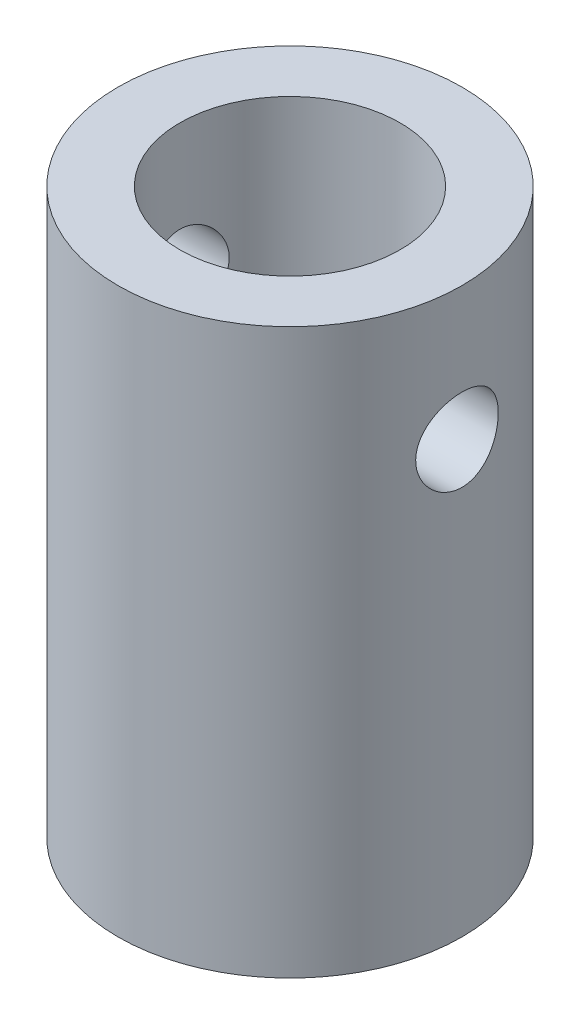
from build123d import *

# Parameters (mm, degrees)
SKETCH_1_R               = 12.5
EXTRUDE_1_DEPTH          = 41
SKETCH_2_R               = 8
CUT_EXTRUDE_1_DEPTH      = 19
CUT_EXTRUDE_2_DEPTH      = 45.648628254
CUT_EXTRUDE_2_DEPTH_BACK = 45.648628254
SKETCH_4_R               = 3


with BuildPart() as part:
    # 草图1 → 凸台-拉伸1 (new body)
    with BuildSketch(Plane(origin=(0, 0, 0), x_dir=(1, 0, 0), z_dir=(0, 1, 0))):
        with Locations(Location((0, 0, 0), (0, 0, 270))):
            Circle(SKETCH_1_R)
        with BuildLine():
            ThreePointArc((1.320081675, 7.281303755), (1.178664494, 7.305528729), (1.036804224, 7.32700737))
            add(Edge.make_bspline(
                [(1.036804224, 7.32700737), (0.981349652, 7.270157618), (0.925664276, 7.213171767), (0.822185543, 7.094937546), (0.774343887, 7.033715099), (0.635290922, 6.847559044), (0.548900943, 6.720025237), (0.477457546, 6.587144437)],
                knots=[0, 0, 0, 0, 0.25, 0.25, 0.5, 0.5, 1, 1, 1, 1], degree=3))
            add(Edge.make_bspline(
                [(0.477457546, 6.587144437), (0.465670482, 6.560002351), (0.446966495, 6.534634966), (0.392581447, 6.494187019), (0.354923032, 6.479375673), (0.274403838, 6.478342584), (0.234194601, 6.492926686), (0.177477992, 6.534562396), (0.158353178, 6.560913911), (0.146609234, 6.588640193)],
                knots=[0, 0, 0, 0, 0.25, 0.25, 0.5, 0.5, 0.75, 0.75, 1, 1, 1, 1], degree=3))
            add(Edge.make_bspline(
                [(0.146609234, 6.588640193), (0.087406412, 6.729534896), (0.022470706, 6.869008306), (-0.095794127, 7.071358543), (-0.138881021, 7.137641916), (-0.232486032, 7.266772188), (-0.282985734, 7.329709482), (-0.333258041, 7.392492075)],
                knots=[0, 0, 0, 0, 0.5, 0.5, 0.75, 0.75, 1, 1, 1, 1], degree=3))
            ThreePointArc((-0.333258041, 7.392492075), (-0.476520161, 7.384641395), (-0.619603145, 7.374014642))
            add(Edge.make_bspline(
                [(-0.619603145, 7.374014642), (-0.661016756, 7.306295373), (-0.702626315, 7.238396061), (-0.777131852, 7.100013493), (-0.810027468, 7.029653931), (-0.904545173, 6.817549796), (-0.961750638, 6.674495088), (-1.001808258, 6.529141787)],
                knots=[0, 0, 0, 0, 0.25, 0.25, 0.5, 0.5, 1, 1, 1, 1], degree=3))
            add(Edge.make_bspline(
                [(-1.001808258, 6.529141787), (-1.00726029, 6.500056407), (-1.019851275, 6.471161346), (-1.063877394, 6.419622783), (-1.097300474, 6.396802915), (-1.175575056, 6.377883569), (-1.218016449, 6.383157985), (-1.282568598, 6.411128867), (-1.307075952, 6.432562592), (-1.32469435, 6.456979365)],
                knots=[0, 0, 0, 0, 0.25, 0.25, 0.5, 0.5, 0.75, 0.75, 1, 1, 1, 1], degree=3))
            add(Edge.make_bspline(
                [(-1.32469435, 6.456979365), (-1.413614574, 6.580958145), (-1.50733275, 6.702515874), (-1.667328953, 6.873226276), (-1.724044413, 6.928139193), (-1.843879738, 7.033004611), (-1.907009881, 7.083047862), (-1.969886807, 7.132989973)],
                knots=[0, 0, 0, 0, 0.5, 0.5, 0.75, 0.75, 1, 1, 1, 1], degree=3))
            ThreePointArc((-1.969886807, 7.132989973), (-2.107810106, 7.093457306), (-2.244941026, 7.051258028))
            add(Edge.make_bspline(
                [(-2.244941026, 7.051258028), (-2.270240634, 6.976112089), (-2.295690848, 6.900747155), (-2.337400908, 6.749436272), (-2.353691732, 6.673613581), (-2.399065606, 6.44603228), (-2.424376538, 6.293898001), (-2.431078977, 6.143425776)],
                knots=[0, 0, 0, 0, 0.25, 0.25, 0.5, 0.5, 1, 1, 1, 1], degree=3))
            add(Edge.make_bspline(
                [(-2.431078977, 6.143425776), (-2.429922179, 6.113855693), (-2.435767989, 6.082881938), (-2.467225283, 6.0228357), (-2.494736026, 5.993149765), (-2.566842089, 5.957290187), (-2.609389832, 5.952991684), (-2.678542057, 5.965898104), (-2.707202858, 5.981340256), (-2.729811991, 6.001223702)],
                knots=[0, 0, 0, 0, 0.25, 0.25, 0.5, 0.5, 0.75, 0.75, 1, 1, 1, 1], degree=3))
            add(Edge.make_bspline(
                [(-2.729811991, 6.001223702), (-2.843877091, 6.102118361), (-2.961914777, 6.199724831), (-3.155568152, 6.330271891), (-3.222981858, 6.371086663), (-3.362905878, 6.446499746), (-3.43545494, 6.481176752), (-3.507737223, 6.51580997)],
                knots=[0, 0, 0, 0, 0.5, 0.5, 0.75, 0.75, 1, 1, 1, 1], degree=3))
            ThreePointArc((-3.507737223, 6.51580997), (-3.633405651, 6.446577647), (-3.75770819, 6.374921893))
            add(Edge.make_bspline(
                [(-3.75770819, 6.374921893), (-3.765661335, 6.296145746), (-3.773711673, 6.217123105), (-3.780628654, 6.060577536), (-3.779555086, 5.98316972), (-3.773567953, 5.751425564), (-3.765597829, 5.597330834), (-3.738685008, 5.449337815)],
                knots=[0, 0, 0, 0, 0.25, 0.25, 0.5, 0.5, 1, 1, 1, 1], degree=3))
            add(Edge.make_bspline(
                [(-3.738685008, 5.449337815), (-3.730977122, 5.420766048), (-3.729784017, 5.389267097), (-3.747092837, 5.323723878), (-3.767310281, 5.288659422), (-3.829632001, 5.237655307), (-3.870154862, 5.22399952), (-3.940441778, 5.221196026), (-3.971819073, 5.229873103), (-3.998285223, 5.244226695)],
                knots=[0, 0, 0, 0, 0.25, 0.25, 0.5, 0.5, 0.75, 0.75, 1, 1, 1, 1], degree=3))
            add(Edge.make_bspline(
                [(-3.998285223, 5.244226695), (-4.131679459, 5.317066828), (-4.268286416, 5.385729002), (-4.485811662, 5.469600321), (-4.560473939, 5.49433348), (-4.713371018, 5.53663568), (-4.791666925, 5.5542605), (-4.869695047, 5.571900047)],
                knots=[0, 0, 0, 0, 0.5, 0.5, 0.75, 0.75, 1, 1, 1, 1], degree=3))
            ThreePointArc((-4.869695047, 5.571900047), (-4.976807064, 5.476439667), (-5.082048173, 5.378920556))
            add(Edge.make_bspline(
                [(-5.082048173, 5.378920556), (-5.072307151, 5.300480381), (-5.062604806, 5.221779379), (-5.034518787, 5.06791266), (-5.016219273, 4.992847823), (-4.959223265, 4.768468173), (-4.918131697, 4.619753183), (-4.859057524, 4.481682373)],
                knots=[0, 0, 0, 0, 0.25, 0.25, 0.5, 0.5, 1, 1, 1, 1], degree=3))
            add(Edge.make_bspline(
                [(-4.859057524, 4.481682373), (-4.845184968, 4.455541927), (-4.837012483, 4.425097777), (-4.839303133, 4.357344949), (-4.851211988, 4.318660124), (-4.90062315, 4.255067306), (-4.93709085, 4.232738081), (-5.004990319, 4.214365565), (-5.037511239, 4.215842974), (-5.066507502, 4.223947335)],
                knots=[0, 0, 0, 0, 0.25, 0.25, 0.5, 0.5, 0.75, 0.75, 1, 1, 1, 1], degree=3))
            add(Edge.make_bspline(
                [(-5.066507502, 4.223947335), (-5.212479984, 4.265197318), (-5.360842679, 4.301259016), (-5.591236122, 4.334292186), (-5.669365776, 4.341792836), (-5.827522419, 4.349018186), (-5.907622429, 4.348769055), (-5.987466028, 4.348591789)],
                knots=[0, 0, 0, 0, 0.5, 0.5, 0.75, 0.75, 1, 1, 1, 1], degree=3))
            ThreePointArc((-5.987466028, 4.348591789), (-6.07065059, 4.231690135), (-6.151553041, 4.113197681))
            add(Edge.make_bspline(
                [(-6.151553041, 4.113197681), (-6.124665563, 4.039025234), (-6.097756481, 3.964591682), (-6.036232892, 3.821126102), (-6.001721665, 3.75217647), (-5.896624578, 3.54632475), (-5.824172679, 3.410224986), (-5.73601637, 3.288981735)],
                knots=[0, 0, 0, 0, 0.25, 0.25, 0.5, 0.5, 1, 1, 1, 1], degree=3))
            add(Edge.make_bspline(
                [(-5.73601637, 3.288981735), (-5.716674868, 3.26658366), (-5.70193286, 3.238721432), (-5.68908961, 3.172157886), (-5.692091566, 3.131793216), (-5.726112744, 3.058799878), (-5.756697382, 3.028915331), (-5.818806502, 2.995894044), (-5.850840963, 2.990097794), (-5.880913702, 2.99154669)],
                knots=[0, 0, 0, 0, 0.25, 0.25, 0.5, 0.5, 0.75, 0.75, 1, 1, 1, 1], degree=3))
            add(Edge.make_bspline(
                [(-5.880913702, 2.99154669), (-6.03212545, 2.999266228), (-6.184669855, 3.000659405), (-6.416269572, 2.981259188), (-6.493951948, 2.971250179), (-6.649452266, 2.943197824), (-6.727342999, 2.925149799), (-6.80500046, 2.907226981)],
                knots=[0, 0, 0, 0, 0.5, 0.5, 0.75, 0.75, 1, 1, 1, 1], degree=3))
            ThreePointArc((-6.80500046, 2.907226981), (-6.860086346, 2.774745989), (-6.912593353, 2.641221899))
            add(Edge.make_bspline(
                [(-6.912593353, 2.641221899), (-6.869966678, 2.575015519), (-6.82725982, 2.508561801), (-6.73553422, 2.382638228), (-6.686632649, 2.323229472), (-6.538755143, 2.146143868), (-6.438293852, 2.029438921), (-6.325587166, 1.931042891)],
                knots=[0, 0, 0, 0, 0.25, 0.25, 0.5, 0.5, 1, 1, 1, 1], degree=3))
            add(Edge.make_bspline(
                [(-6.325587166, 1.931042891), (-6.301746825, 1.91351047), (-6.281174899, 1.889627674), (-6.253842011, 1.827592924), (-6.247786065, 1.787573767), (-6.264709487, 1.708840723), (-6.287877013, 1.67289766), (-6.341082222, 1.626881406), (-6.371024466, 1.614101801), (-6.400666096, 1.608822473)],
                knots=[0, 0, 0, 0, 0.25, 0.25, 0.5, 0.5, 0.75, 0.75, 1, 1, 1, 1], degree=3))
            add(Edge.make_bspline(
                [(-6.400666096, 1.608822473), (-6.549559073, 1.582743795), (-6.698324927, 1.549172856), (-6.919406344, 1.478394292), (-6.992789955, 1.451467307), (-7.137909136, 1.389684274), (-7.209706127, 1.354796727), (-7.281303754, 1.320081673)],
                knots=[0, 0, 0, 0, 0.5, 0.5, 0.75, 0.75, 1, 1, 1, 1], degree=3))
            ThreePointArc((-7.281303754, 1.320081673), (-7.305528728, 1.178664492), (-7.327007369, 1.036804222))
            add(Edge.make_bspline(
                [(-7.327007369, 1.036804222), (-7.270829338, 0.981845361), (-7.214517578, 0.926666067), (-7.097308165, 0.824494804), (-7.03653664, 0.77754061), (-6.853346183, 0.638018121), (-6.729723914, 0.546669005), (-6.598206372, 0.475958565)],
                knots=[0, 0, 0, 0, 0.25, 0.25, 0.5, 0.5, 1, 1, 1, 1], degree=3))
            add(Edge.make_bspline(
                [(-6.598206372, 0.475958565), (-6.571624676, 0.463639432), (-6.546877047, 0.444637459), (-6.507538992, 0.390166285), (-6.493277365, 0.35281192), (-6.492280061, 0.273518396), (-6.506240232, 0.233785027), (-6.546781433, 0.176863082), (-6.572509336, 0.157415149), (-6.599702128, 0.145110252)],
                knots=[0, 0, 0, 0, 0.25, 0.25, 0.5, 0.5, 0.75, 0.75, 1, 1, 1, 1], degree=3))
            add(Edge.make_bspline(
                [(-6.599702128, 0.145110252), (-6.738870055, 0.086632861), (-6.875941631, 0.019665553), (-7.0753157, -0.09884181), (-7.140797266, -0.141273025), (-7.268373923, -0.233592416), (-7.330511035, -0.283531059), (-7.392492073, -0.333258043)],
                knots=[0, 0, 0, 0, 0.5, 0.5, 0.75, 0.75, 1, 1, 1, 1], degree=3))
            ThreePointArc((-7.392492073, -0.333258043), (-7.384641393, -0.476520163), (-7.37401464, -0.619603147))
            add(Edge.make_bspline(
                [(-7.37401464, -0.619603147), (-7.307137232, -0.660609027), (-7.240080525, -0.70179702), (-7.103332749, -0.775228732), (-7.033771874, -0.807459702), (-6.824506901, -0.902506121), (-6.683886012, -0.96371013), (-6.540203721, -1.00330724)],
                knots=[0, 0, 0, 0, 0.25, 0.25, 0.5, 0.5, 1, 1, 1, 1], degree=3))
            add(Edge.make_bspline(
                [(-6.540203721, -1.00330724), (-6.511347253, -1.00910232), (-6.48273997, -1.021921219), (-6.431772233, -1.066116529), (-6.409274205, -1.099443431), (-6.390513759, -1.177071883), (-6.395515724, -1.219205987), (-6.422889995, -1.283735746), (-6.44396635, -1.308345255), (-6.4680413, -1.326193332)],
                knots=[0, 0, 0, 0, 0.25, 0.25, 0.5, 0.5, 0.75, 0.75, 1, 1, 1, 1], degree=3))
            add(Edge.make_bspline(
                [(-6.4680413, -1.326193332), (-6.59058573, -1.414084809), (-6.708551771, -1.511042288), (-6.876132512, -1.671225086), (-6.930522798, -1.727007263), (-7.034294677, -1.845195621), (-7.0836949, -1.907661656), (-7.132989972, -1.969886809)],
                knots=[0, 0, 0, 0, 0.5, 0.5, 0.75, 0.75, 1, 1, 1, 1], degree=3))
            ThreePointArc((-7.132989972, -1.969886809), (-7.093457304, -2.107810108), (-7.051258027, -2.244941028))
            add(Edge.make_bspline(
                [(-7.051258027, -2.244941028), (-6.977050626, -2.269992264), (-6.902628683, -2.295178254), (-6.753208403, -2.336331226), (-6.678338982, -2.352311874), (-6.453543437, -2.398199602), (-6.303121796, -2.425957395), (-6.15448771, -2.432577959)],
                knots=[0, 0, 0, 0, 0.25, 0.25, 0.5, 0.5, 1, 1, 1, 1], degree=3))
            add(Edge.make_bspline(
                [(-6.15448771, -2.432577959), (-6.124965793, -2.431542676), (-6.094067851, -2.437477983), (-6.034193535, -2.469017996), (-6.004615509, -2.49651281), (-5.968842441, -2.568418581), (-5.964471905, -2.610863097), (-5.977193324, -2.679979868), (-5.99252125, -2.70865298), (-6.012285637, -2.731310973)],
                knots=[0, 0, 0, 0, 0.25, 0.25, 0.5, 0.5, 0.75, 0.75, 1, 1, 1, 1], degree=3))
            add(Edge.make_bspline(
                [(-6.012285637, -2.731310973), (-6.112142186, -2.844202249), (-6.204549345, -2.966054877), (-6.331861182, -3.159767754), (-6.372526394, -3.226120105), (-6.447417198, -3.364273667), (-6.481637938, -3.436134768), (-6.515809968, -3.507737225)],
                knots=[0, 0, 0, 0, 0.5, 0.5, 0.75, 0.75, 1, 1, 1, 1], degree=3))
            ThreePointArc((-6.515809968, -3.507737225), (-6.446577646, -3.633405653), (-6.374921892, -3.757708191))
            add(Edge.make_bspline(
                [(-6.374921892, -3.757708191), (-6.297102392, -3.765598577), (-6.219045058, -3.773570127), (-6.064397235, -3.7805044), (-5.987928244, -3.779507791), (-5.758921712, -3.774016922), (-5.606565561, -3.76676453), (-5.46039975, -3.740183989)],
                knots=[0, 0, 0, 0, 0.25, 0.25, 0.5, 0.5, 1, 1, 1, 1], degree=3))
            add(Edge.make_bspline(
                [(-5.46039975, -3.740183989), (-5.431823438, -3.732418074), (-5.400308518, -3.731177546), (-5.33472048, -3.748415503), (-5.299616829, -3.768608497), (-5.248540204, -3.830981636), (-5.234880469, -3.871572018), (-5.232141537, -3.941927929), (-5.240873658, -3.973321938), (-5.25528863, -3.999784205)],
                knots=[0, 0, 0, 0, 0.25, 0.25, 0.5, 0.5, 0.75, 0.75, 1, 1, 1, 1], degree=3))
            add(Edge.make_bspline(
                [(-5.25528863, -3.999784205), (-5.327511436, -4.132047912), (-5.389270513, -4.272286498), (-5.469870447, -4.489707851), (-5.494845984, -4.563356811), (-5.537194429, -4.714621993), (-5.55454184, -4.792290433), (-5.571900045, -4.869695049)],
                knots=[0, 0, 0, 0, 0.5, 0.5, 0.75, 0.75, 1, 1, 1, 1], degree=3))
            ThreePointArc((-5.571900045, -4.869695049), (-5.476439666, -4.976807066), (-5.378920554, -5.082048175))
            add(Edge.make_bspline(
                [(-5.378920554, -5.082048175), (-5.301372784, -5.072419594), (-5.223576683, -5.062815368), (-5.071366045, -5.03526514), (-4.997058758, -5.017385835), (-4.77537013, -4.96086732), (-4.629176423, -4.918929556), (-4.492744308, -4.860556506)],
                knots=[0, 0, 0, 0, 0.25, 0.25, 0.5, 0.5, 1, 1, 1, 1], degree=3))
            add(Edge.make_bspline(
                [(-4.492744308, -4.860556506), (-4.466621178, -4.846540536), (-4.436157615, -4.838243813), (-4.368313367, -4.840349291), (-4.329535438, -4.852192893), (-4.265745409, -4.901715291), (-4.243394364, -4.938335211), (-4.225157197, -5.006410791), (-4.226757263, -5.038991519), (-4.23500927, -5.068006484)],
                knots=[0, 0, 0, 0, 0.25, 0.25, 0.5, 0.5, 0.75, 0.75, 1, 1, 1, 1], degree=3))
            add(Edge.make_bspline(
                [(-4.23500927, -5.068006484), (-4.276003086, -5.213071968), (-4.303709719, -5.364153749), (-4.33350538, -5.594282073), (-4.341580001, -5.671613239), (-4.349304528, -5.82851082), (-4.348912849, -5.908116317), (-4.348591788, -5.987466029)],
                knots=[0, 0, 0, 0, 0.5, 0.5, 0.75, 0.75, 1, 1, 1, 1], degree=3))
            ThreePointArc((-4.348591788, -5.987466029), (-4.231690133, -6.070650592), (-4.113197679, -6.151553043))
            add(Edge.make_bspline(
                [(-4.113197679, -6.151553043), (-4.039783557, -6.124908026), (-3.966123502, -6.098230328), (-3.823872386, -6.037603172), (-3.755367485, -6.003743255), (-3.552160678, -5.899099439), (-3.419978777, -5.824720506), (-3.30004367, -5.737515351)],
                knots=[0, 0, 0, 0, 0.25, 0.25, 0.5, 0.5, 1, 1, 1, 1], degree=3))
            add(Edge.make_bspline(
                [(-3.30004367, -5.737515351), (-3.277689092, -5.71805789), (-3.24983757, -5.703209451), (-3.183244495, -5.690191206), (-3.142821582, -5.69311477), (-3.069641505, -5.727178305), (-3.039697099, -5.757887731), (-3.006744701, -5.820180346), (-3.001039092, -5.852293203), (-3.002608625, -5.882412684)],
                knots=[0, 0, 0, 0, 0.25, 0.25, 0.5, 0.5, 0.75, 0.75, 1, 1, 1, 1], degree=3))
            add(Edge.make_bspline(
                [(-3.002608625, -5.882412684), (-3.010300364, -6.033077262), (-3.002439503, -6.186882044), (-2.979889361, -6.418088259), (-2.970658463, -6.495310424), (-2.943353056, -6.650084899), (-2.925226109, -6.727659925), (-2.90722698, -6.805000462)],
                knots=[0, 0, 0, 0, 0.5, 0.5, 0.75, 0.75, 1, 1, 1, 1], degree=3))
            ThreePointArc((-2.90722698, -6.805000462), (-2.774745987, -6.860086348), (-2.641221897, -6.912593354))
            add(Edge.make_bspline(
                [(-2.641221897, -6.912593354), (-2.575596367, -6.870268028), (-2.509739633, -6.827855557), (-2.384476825, -6.737158649), (-2.325130049, -6.688981029), (-2.150649191, -6.541521223), (-2.039600759, -6.438761828), (-1.942104826, -6.327086148)],
                knots=[0, 0, 0, 0, 0.25, 0.25, 0.5, 0.5, 1, 1, 1, 1], degree=3))
            add(Edge.make_bspline(
                [(-1.942104826, -6.327086148), (-1.924576726, -6.303251682), (-1.900704328, -6.282688722), (-1.838714468, -6.25535891), (-1.798727922, -6.249288233), (-1.720006886, -6.266163114), (-1.684018356, -6.289323559), (-1.637952406, -6.342555239), (-1.62516554, -6.37251332), (-1.619884408, -6.402165078)],
                knots=[0, 0, 0, 0, 0.25, 0.25, 0.5, 0.5, 0.75, 0.75, 1, 1, 1, 1], degree=3))
            add(Edge.make_bspline(
                [(-1.619884408, -6.402165078), (-1.593827275, -6.550935046), (-1.550844135, -6.699256637), (-1.477031364, -6.919865933), (-1.450918129, -6.993182563), (-1.389876037, -7.138164228), (-1.354889163, -7.209834281), (-1.320081671, -7.281303756)],
                knots=[0, 0, 0, 0, 0.5, 0.5, 0.75, 0.75, 1, 1, 1, 1], degree=3))
            ThreePointArc((-1.320081671, -7.281303756), (-1.178664491, -7.30552873), (-1.036804221, -7.327007371))
            add(Edge.make_bspline(
                [(-1.036804221, -7.327007371), (-0.982256493, -7.271122895), (-0.927503812, -7.21509805), (-0.825564243, -7.098956368), (-0.778328661, -7.038868824), (-0.641325167, -6.855985119), (-0.557241731, -6.730312994), (-0.487020499, -6.599705353)],
                knots=[0, 0, 0, 0, 0.25, 0.25, 0.5, 0.5, 1, 1, 1, 1], degree=3))
            add(Edge.make_bspline(
                [(-0.487020499, -6.599705353), (-0.47508062, -6.572732966), (-0.456296871, -6.547556103), (-0.401927858, -6.507444512), (-0.364389197, -6.492787345), (-0.284254989, -6.491722616), (-0.244139503, -6.506109386), (-0.187317372, -6.547434913), (-0.16808403, -6.573620987), (-0.156172187, -6.601201109)],
                knots=[0, 0, 0, 0, 0.25, 0.25, 0.5, 0.5, 0.75, 0.75, 1, 1, 1, 1], degree=3))
            add(Edge.make_bspline(
                [(-0.156172187, -6.601201109), (-0.09757707, -6.740649557), (-0.021812833, -6.875679489), (0.09961068, -7.074555161), (0.141367623, -7.140338524), (0.233204147, -7.268305365), (0.283342297, -7.330476435), (0.333258045, -7.392492075)],
                knots=[0, 0, 0, 0, 0.5, 0.5, 0.75, 0.75, 1, 1, 1, 1], degree=3))
            ThreePointArc((0.333258045, -7.392492075), (0.476520165, -7.384641395), (0.619603149, -7.374014642))
            add(Edge.make_bspline(
                [(0.619603149, -7.374014642), (0.660370817, -7.307311833), (0.701308061, -7.240430228), (0.775084868, -7.104238162), (0.80792671, -7.035045769), (0.900383072, -6.826095977), (0.952825915, -6.684740119), (0.992245305, -6.541702703)],
                knots=[0, 0, 0, 0, 0.25, 0.25, 0.5, 0.5, 1, 1, 1, 1], degree=3))
            add(Edge.make_bspline(
                [(0.992245305, -6.541702703), (0.997695814, -6.512625446), (1.010280616, -6.483744594), (1.05426251, -6.4322312), (1.087645053, -6.409412425), (1.165883135, -6.390449487), (1.208367328, -6.395694154), (1.272983503, -6.42366762), (1.29750615, -6.445114017), (1.315131397, -6.469540282)],
                knots=[0, 0, 0, 0, 0.25, 0.25, 0.5, 0.5, 0.75, 0.75, 1, 1, 1, 1], degree=3))
            add(Edge.make_bspline(
                [(1.315131397, -6.469540282), (1.403440777, -6.592667381), (1.507935267, -6.70743162), (1.670932878, -6.874532703), (1.726326575, -6.929495134), (1.84449087, -7.034020792), (1.90731599, -7.083555964), (1.96988681, -7.132989974)],
                knots=[0, 0, 0, 0, 0.5, 0.5, 0.75, 0.75, 1, 1, 1, 1], degree=3))
            ThreePointArc((1.96988681, -7.132989974), (2.10781011, -7.093457306), (2.244941029, -7.051258029))
            add(Edge.make_bspline(
                [(2.244941029, -7.051258029), (2.269850955, -6.97706445), (2.294886901, -6.902658683), (2.336639302, -6.753282033), (2.353386828, -6.678422881), (2.396638686, -6.453899016), (2.414906715, -6.304368104), (2.421516024, -6.155986692)],
                knots=[0, 0, 0, 0, 0.25, 0.25, 0.5, 0.5, 1, 1, 1, 1], degree=3))
            add(Edge.make_bspline(
                [(2.421516024, -6.155986692), (2.420359756, -6.126430154), (2.426069122, -6.095760585), (2.457666065, -6.035331432), (2.485143193, -6.005707167), (2.557440536, -5.969789245), (2.599530869, -5.965522609), (2.669026951, -5.978442785), (2.697639292, -5.993900633), (2.720249038, -6.013784619)],
                knots=[0, 0, 0, 0, 0.25, 0.25, 0.5, 0.5, 0.75, 0.75, 1, 1, 1, 1], degree=3))
            add(Edge.make_bspline(
                [(2.720249038, -6.013784619), (2.833958278, -6.114364687), (2.96170608, -6.203082965), (3.158160332, -6.32996766), (3.224498157, -6.371323427), (3.363196324, -6.447096548), (3.435603286, -6.481473533), (3.507737226, -6.51580997)],
                knots=[0, 0, 0, 0, 0.5, 0.5, 0.75, 0.75, 1, 1, 1, 1], degree=3))
            ThreePointArc((3.507737226, -6.51580997), (3.633405654, -6.446577648), (3.757708193, -6.374921894))
            add(Edge.make_bspline(
                [(3.757708193, -6.374921894), (3.765474725, -6.296929183), (3.773317868, -6.218701023), (3.780860724, -6.06352427), (3.780615647, -5.986675003), (3.772409597, -5.757927451), (3.755734547, -5.608240252), (3.729122055, -5.461898731)],
                knots=[0, 0, 0, 0, 0.25, 0.25, 0.5, 0.5, 1, 1, 1, 1], degree=3))
            add(Edge.make_bspline(
                [(3.729122055, -5.461898731), (3.721416488, -5.433335564), (3.720234331, -5.401798135), (3.737502505, -5.336368127), (3.75765594, -5.301330536), (3.81997129, -5.25026093), (3.860512936, -5.236574857), (3.930842794, -5.233747128), (3.962245648, -5.242428341), (3.98872227, -5.256787612)],
                knots=[0, 0, 0, 0, 0.25, 0.25, 0.5, 0.5, 0.75, 0.75, 1, 1, 1, 1], degree=3))
            add(Edge.make_bspline(
                [(3.98872227, -5.256787612), (4.122223545, -5.329686194), (4.266671227, -5.388035486), (4.48679327, -5.46828415), (4.560814601, -5.493894216), (4.713190585, -5.536993747), (4.791581443, -5.55443533), (4.86969505, -5.571900047)],
                knots=[0, 0, 0, 0, 0.5, 0.5, 0.75, 0.75, 1, 1, 1, 1], degree=3))
            ThreePointArc((4.86969505, -5.571900047), (4.976807067, -5.476439668), (5.082048177, -5.378920556))
            add(Edge.make_bspline(
                [(5.082048177, -5.378920556), (5.072230204, -5.301023499), (5.062435763, -5.222878746), (5.035256042, -5.069618206), (5.017944368, -4.994585651), (4.958615658, -4.773190078), (4.908104484, -4.631229012), (4.849494571, -4.49424329)],
                knots=[0, 0, 0, 0, 0.25, 0.25, 0.5, 0.5, 1, 1, 1, 1], degree=3))
            add(Edge.make_bspline(
                [(4.849494571, -4.49424329), (4.835616181, -4.468091849), (4.82742791, -4.437775543), (4.829768155, -4.369602472), (4.841358939, -4.331530264), (4.891563585, -4.267044762), (4.927578901, -4.245279052), (4.995435031, -4.226930557), (5.027959785, -4.228407105), (5.056944549, -4.236508252)],
                knots=[0, 0, 0, 0, 0.25, 0.25, 0.5, 0.5, 0.75, 0.75, 1, 1, 1, 1], degree=3))
            add(Edge.make_bspline(
                [(5.056944549, -4.236508252), (5.203602865, -4.277952184), (5.357503846, -4.303228143), (5.590327448, -4.332763287), (5.668353867, -4.341254566), (5.826814134, -4.34936546), (5.907273351, -4.34893547), (5.987466031, -4.34859179)],
                knots=[0, 0, 0, 0, 0.5, 0.5, 0.75, 0.75, 1, 1, 1, 1], degree=3))
            ThreePointArc((5.987466031, -4.34859179), (6.070650593, -4.231690135), (6.151553044, -4.113197681))
            add(Edge.make_bspline(
                [(6.151553044, -4.113197681), (6.124583135, -4.039304217), (6.097582281, -3.965162295), (6.036886714, -3.821494048), (6.003278495, -3.752033399), (5.895740816, -3.549204005), (5.8142434, -3.422282087), (5.726453416, -3.301542652)],
                knots=[0, 0, 0, 0, 0.25, 0.25, 0.5, 0.5, 1, 1, 1, 1], degree=3))
            add(Edge.make_bspline(
                [(5.726453416, -3.301542652), (5.707115492, -3.279148719), (5.692380097, -3.251285782), (5.679535315, -3.184812979), (5.682557949, -3.144179133), (5.716699766, -3.071151665), (5.746867427, -3.041630157), (5.809415926, -3.008351378), (5.841300645, -3.002659801), (5.871350749, -3.004107606)],
                knots=[0, 0, 0, 0, 0.25, 0.25, 0.5, 0.5, 0.75, 0.75, 1, 1, 1, 1], degree=3))
            add(Edge.make_bspline(
                [(5.871350749, -3.004107606), (6.023828682, -3.011891921), (6.179631424, -3.003072451), (6.413565409, -2.980358974), (6.491678395, -2.971209579), (6.648263694, -2.94376439), (6.726752763, -2.925423003), (6.805000463, -2.907226982)],
                knots=[0, 0, 0, 0, 0.5, 0.5, 0.75, 0.75, 1, 1, 1, 1], degree=3))
            ThreePointArc((6.805000463, -2.907226982), (6.860086349, -2.774745989), (6.912593356, -2.641221899))
            add(Edge.make_bspline(
                [(6.912593356, -2.641221899), (6.869764682, -2.575058863), (6.826851516, -2.508658174), (6.735532409, -2.381837093), (6.687221535, -2.321464742), (6.536822947, -2.147482722), (6.428704851, -2.041977097), (6.316024213, -1.943603808)],
                knots=[0, 0, 0, 0, 0.25, 0.25, 0.5, 0.5, 1, 1, 1, 1], degree=3))
            add(Edge.make_bspline(
                [(6.316024213, -1.943603808), (6.2922028, -1.926085306), (6.271651917, -1.902231085), (6.244322403, -1.840300295), (6.238219619, -1.80007818), (6.255178792, -1.721324441), (6.278134548, -1.685622461), (6.331648587, -1.639321858), (6.361473632, -1.626660559), (6.391103143, -1.62138339)],
                knots=[0, 0, 0, 0, 0.25, 0.25, 0.5, 0.5, 0.75, 0.75, 1, 1, 1, 1], degree=3))
            add(Edge.make_bspline(
                [(6.391103143, -1.62138339), (6.541729216, -1.595001159), (6.691947572, -1.552723515), (6.91535722, -1.478839564), (6.989595585, -1.452422514), (7.136382964, -1.390656815), (7.208944939, -1.355270783), (7.281303757, -1.320081673)],
                knots=[0, 0, 0, 0, 0.5, 0.5, 0.75, 0.75, 1, 1, 1, 1], degree=3))
            ThreePointArc((7.281303757, -1.320081673), (7.305528731, -1.178664493), (7.327007372, -1.036804223))
            add(Edge.make_bspline(
                [(7.327007372, -1.036804223), (7.270516284, -0.981524202), (7.213846991, -0.926100449), (7.096137233, -0.823440055), (7.035290399, -0.775846781), (6.912053504, -0.683229244), (6.849785585, -0.638082087), (6.721178436, -0.557651365), (6.655248606, -0.52212664), (6.588643419, -0.488519481)],
                knots=[0, 0, 0, 0, 0.25, 0.25, 0.5, 0.5, 0.75, 0.75, 1, 1, 1, 1], degree=3))
            add(Edge.make_bspline(
                [(6.588643419, -0.488519481), (6.561514448, -0.476738112), (6.536164366, -0.45804855), (6.495734212, -0.403728945), (6.480880632, -0.36632396), (6.479835774, -0.285141211), (6.494187286, -0.245600896), (6.536230185, -0.188290374), (6.562423342, -0.169410687), (6.590139175, -0.157671168)],
                knots=[0, 0, 0, 0, 0.25, 0.25, 0.5, 0.5, 0.75, 0.75, 1, 1, 1, 1], degree=3))
            add(Edge.make_bspline(
                [(6.590139175, -0.157671168), (6.731618186, -0.099892576), (6.869008549, -0.025561734), (7.070502773, 0.096970962), (7.137119202, 0.13919962), (7.266757099, 0.231958075), (7.329709779, 0.282708601), (7.392492077, 0.333258043)],
                knots=[0, 0, 0, 0, 0.5, 0.5, 0.75, 0.75, 1, 1, 1, 1], degree=3))
            ThreePointArc((7.392492077, 0.333258043), (7.384641397, 0.476520163), (7.374014644, 0.619603147))
            add(Edge.make_bspline(
                [(7.374014644, 0.619603147), (7.306468659, 0.660973002), (7.238741538, 0.702534707), (7.100647141, 0.776668242), (7.030396295, 0.809267586), (6.81893941, 0.904598163), (6.676384082, 0.963426857), (6.530640768, 0.990746324)],
                knots=[0, 0, 0, 0, 0.25, 0.25, 0.5, 0.5, 1, 1, 1, 1], degree=3))
            add(Edge.make_bspline(
                [(6.530640768, 0.990746324), (6.501535922, 0.996202004), (6.472626588, 1.00880555), (6.421078038, 1.052865443), (6.398257212, 1.086312078), (6.379372333, 1.164667049), (6.384468218, 1.20646111), (6.412724381, 1.27178706), (6.434058856, 1.296012056), (6.458478347, 1.313632416)],
                knots=[0, 0, 0, 0, 0.25, 0.25, 0.5, 0.5, 0.75, 0.75, 1, 1, 1, 1], degree=3))
            add(Edge.make_bspline(
                [(6.458478347, 1.313632416), (6.583020119, 1.402956429), (6.701516533, 1.504128764), (6.871668459, 1.667094161), (6.927135265, 1.723414572), (7.032747432, 1.843193705), (7.082917285, 1.906673569), (7.132989975, 1.969886808)],
                knots=[0, 0, 0, 0, 0.5, 0.5, 0.75, 0.75, 1, 1, 1, 1], degree=3))
            ThreePointArc((7.132989975, 1.969886808), (7.093457308, 2.107810107), (7.05125803, 2.244941027))
            add(Edge.make_bspline(
                [(7.05125803, 2.244941027), (6.976123482, 2.270098672), (6.90077238, 2.295397669), (6.749499886, 2.337738569), (6.673684072, 2.354788173), (6.446404299, 2.397255152), (6.29518101, 2.413324223), (6.144924757, 2.420017042)],
                knots=[0, 0, 0, 0, 0.25, 0.25, 0.5, 0.5, 1, 1, 1, 1], degree=3))
            add(Edge.make_bspline(
                [(6.144924757, 2.420017042), (6.115353349, 2.418860193), (6.08438367, 2.42470716), (6.024353162, 2.45615112), (5.994671318, 2.483644944), (5.958795376, 2.555751447), (5.954486424, 2.598308902), (5.967402611, 2.667505998), (5.982835711, 2.696136913), (6.002722684, 2.718750056)],
                knots=[0, 0, 0, 0, 0.25, 0.25, 0.5, 0.5, 0.75, 0.75, 1, 1, 1, 1], degree=3))
            add(Edge.make_bspline(
                [(6.002722684, 2.718750056), (6.104321518, 2.833611046), (6.198325922, 2.957582622), (6.328409081, 3.154026668), (6.369904804, 3.22140816), (6.446190694, 3.361852276), (6.481018113, 3.434935331), (6.515809972, 3.507737224)],
                knots=[0, 0, 0, 0, 0.5, 0.5, 0.75, 0.75, 1, 1, 1, 1], degree=3))
            ThreePointArc((6.515809972, 3.507737224), (6.446577649, 3.633405652), (6.374921895, 3.757708191))
            add(Edge.make_bspline(
                [(6.374921895, 3.757708191), (6.29597216, 3.765535964), (6.216778544, 3.773455767), (6.059694968, 3.781012337), (5.981908224, 3.780679225), (5.750513806, 3.771707425), (5.599018388, 3.754570186), (5.450836797, 3.727623073)],
                knots=[0, 0, 0, 0, 0.25, 0.25, 0.5, 0.5, 1, 1, 1, 1], degree=3))
            add(Edge.make_bspline(
                [(5.450836797, 3.727623073), (5.422269722, 3.719916453), (5.390781492, 3.718724219), (5.325269074, 3.736012496), (5.29021799, 3.756203502), (5.239194928, 3.818492501), (5.225503195, 3.8589321), (5.222689617, 3.929558189), (5.231367667, 3.960748992), (5.245725677, 3.987223289)],
                knots=[0, 0, 0, 0, 0.25, 0.25, 0.5, 0.5, 0.75, 0.75, 1, 1, 1, 1], degree=3))
            add(Edge.make_bspline(
                [(5.245725677, 3.987223289), (5.319227867, 4.121829968), (5.384454863, 4.262762424), (5.468028644, 4.482955262), (5.493400136, 4.557968838), (5.536438915, 4.711961858), (5.554155882, 4.790969054), (5.571900049, 4.869695048)],
                knots=[0, 0, 0, 0, 0.5, 0.5, 0.75, 0.75, 1, 1, 1, 1], degree=3))
            ThreePointArc((5.571900049, 4.869695048), (5.476439669, 4.976807065), (5.378920558, 5.082048175))
            add(Edge.make_bspline(
                [(5.378920558, 5.082048175), (5.300132953, 5.072116586), (5.221085492, 5.0622223), (5.066158841, 5.034531593), (4.990375089, 5.016789561), (4.766411503, 4.956777557), (4.621793656, 4.907301441), (4.483181355, 4.847995589)],
                knots=[0, 0, 0, 0, 0.25, 0.25, 0.5, 0.5, 1, 1, 1, 1], degree=3))
            add(Edge.make_bspline(
                [(4.483181355, 4.847995589), (4.457066232, 4.834136473), (4.426660482, 4.825969411), (4.359003126, 4.828214868), (4.320370279, 4.840061994), (4.256778249, 4.889321007), (4.23436945, 4.925753843), (4.215881498, 4.993653272), (4.217336374, 5.026429331), (4.225446317, 5.055445567)],
                knots=[0, 0, 0, 0, 0.25, 0.25, 0.5, 0.5, 0.75, 0.75, 1, 1, 1, 1], degree=3))
            add(Edge.make_bspline(
                [(4.225446317, 5.055445567), (4.267140485, 5.202989399), (4.300618626, 5.354293147), (4.333553353, 5.587316852), (4.34148679, 5.666126358), (4.34907694, 5.825839962), (4.348790505, 5.906786554), (4.348591791, 5.987466029)],
                knots=[0, 0, 0, 0, 0.5, 0.5, 0.75, 0.75, 1, 1, 1, 1], degree=3))
            ThreePointArc((4.348591791, 5.987466029), (4.231690137, 6.070650591), (4.113197683, 6.151553042))
            add(Edge.make_bspline(
                [(4.113197683, 6.151553042), (4.038549306, 6.124340883), (3.963637644, 6.097108475), (3.818748999, 6.035532034), (3.748852828, 6.001266617), (3.543478443, 5.89316687), (3.412498515, 5.81367392), (3.290480717, 5.724954435)],
                knots=[0, 0, 0, 0, 0.25, 0.25, 0.5, 0.5, 1, 1, 1, 1], degree=3))
            add(Edge.make_bspline(
                [(3.290480717, 5.724954435), (3.268086188, 5.705615995), (3.240231879, 5.690878194), (3.173697172, 5.6780304), (3.133350797, 5.681018279), (3.06035742, 5.715007581), (3.0304433, 5.74559464), (2.997394952, 5.807727242), (2.99159646, 5.839772479), (2.993045671, 5.869851767)],
                knots=[0, 0, 0, 0, 0.25, 0.25, 0.5, 0.5, 0.75, 0.75, 1, 1, 1, 1], degree=3))
            add(Edge.make_bspline(
                [(2.993045671, 5.869851767), (3.000857333, 6.02286537), (3.001047925, 6.177466621), (2.981732437, 6.411751372), (2.971826864, 6.490321319), (2.943605747, 6.647633442), (2.925344909, 6.726436986), (2.907226983, 6.805000461)],
                knots=[0, 0, 0, 0, 0.5, 0.5, 0.75, 0.75, 1, 1, 1, 1], degree=3))
            ThreePointArc((2.907226983, 6.805000461), (2.77474599, 6.860086347), (2.641221901, 6.912593354))
            add(Edge.make_bspline(
                [(2.641221901, 6.912593354), (2.574481743, 6.869465326), (2.507488012, 6.826259582), (2.380009303, 6.733918739), (2.319583382, 6.68488365), (2.143015658, 6.534048344), (2.03178029, 6.428196822), (1.932541873, 6.314525231)],
                knots=[0, 0, 0, 0, 0.25, 0.25, 0.5, 0.5, 1, 1, 1, 1], degree=3))
            add(Edge.make_bspline(
                [(1.932541873, 6.314525231), (1.91501131, 6.290687417), (1.891133094, 6.270119452), (1.829117949, 6.242787901), (1.789112841, 6.236725425), (1.710384291, 6.253628066), (1.674421508, 6.276792877), (1.628384196, 6.330009338), (1.61560155, 6.359958226), (1.610321455, 6.389604161)],
                knots=[0, 0, 0, 0, 0.25, 0.25, 0.5, 0.5, 0.75, 0.75, 1, 1, 1, 1], degree=3))
            add(Edge.make_bspline(
                [(1.610321455, 6.389604161), (1.583917408, 6.540354788), (1.550790444, 6.690979575), (1.480219435, 6.914873993), (1.453007244, 6.989189299), (1.390466236, 7.136118811), (1.35517888, 7.208812208), (1.320081675, 7.281303755)],
                knots=[0, 0, 0, 0, 0.5, 0.5, 0.75, 0.75, 1, 1, 1, 1], degree=3))
        make_face(mode=Mode.SUBTRACT)
    extrude(amount=EXTRUDE_1_DEPTH)

    # 草图2 → 切除-拉伸1 (cut)
    with BuildSketch(Plane(origin=(0, 41, 0), x_dir=(1, 0, 0), z_dir=(0, 1, 0))):
        with Locations(Location((0, 0, 0), (0, 0, 270))):
            Circle(SKETCH_2_R)
    extrude(amount=-CUT_EXTRUDE_1_DEPTH, mode=Mode.SUBTRACT)

    # 草图4 → 切除-拉伸2 (cut, two sides: drawn at the far end of the back side and taken through both)
    with BuildSketch(Plane(origin=(0, 0, 0), x_dir=(0, 0, -1), z_dir=(1, 0, 0)).offset(-CUT_EXTRUDE_2_DEPTH_BACK)):
        with Locations((0, 31.3)):
            Circle(SKETCH_4_R)
    extrude(amount=CUT_EXTRUDE_2_DEPTH + CUT_EXTRUDE_2_DEPTH_BACK, mode=Mode.SUBTRACT)


solid = part.part
